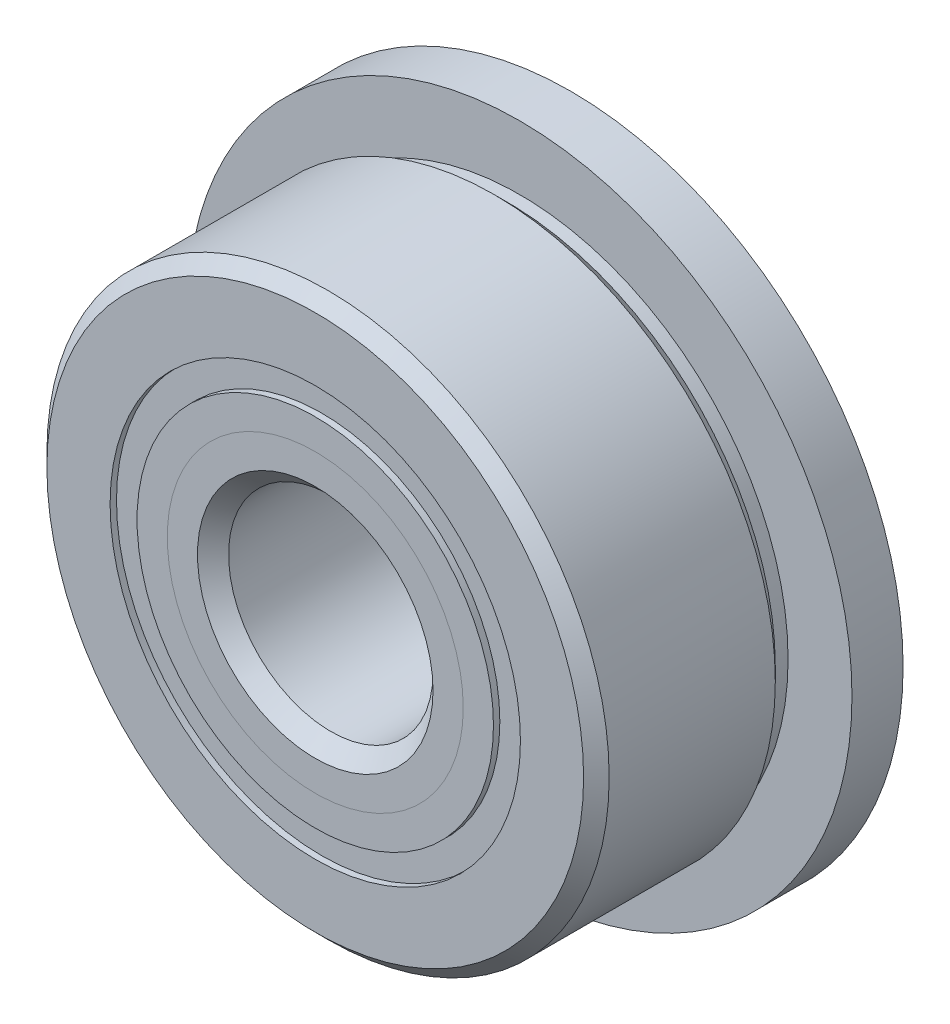
from build123d import *

# Parameters (mm, degrees)
SKETCH5_W         = 1.5875
SKETCH5_H         = 2.965659341
CIRPATTERN1_COUNT = 10
SKETCH7_W         = 1.957414803
SKETCH7_H         = 0.837362638


with BuildPart() as part:
    # Sketch1 → Revolve1 (revolve)
    with BuildSketch(Plane(origin=(0, 0, 0), x_dir=(0, 0, -1), z_dir=(1, 0, 0)), mode=Mode.PRIVATE) as revolve1_sk:
        with BuildLine():
            Line((3.571875, 8.73125), (-3.571875, 8.73125))
            Line((-3.571875, 8.73125), (-3.96875, 8.334375))
            Line((-3.96875, 8.334375), (-3.96875, 6.371806319))
            Line((-3.96875, 6.371806319), (-1.763888889, 6.371806319))
            ThreePointArc((-1.763888889, 6.371806319), (0, 7.766022697), (1.763888889, 6.371806319))
            Line((1.763888889, 6.371806319), (3.96875, 6.371806319))
            Line((3.96875, 6.371806319), (3.96875, 8.334375))
            Line((3.96875, 8.334375), (3.571875, 8.73125))
        make_face()
    revolve(revolve1_sk.sketch.rotate(Axis((0, 0, 3.96875), (0, 0, -1)), 90), axis=Axis((0, 0, 3.96875), (0, 0, -1)))

    # Sketch5 → Revolve5 (revolve)
    with BuildSketch(Plane(origin=(0, 0, 0), x_dir=(0, 0, -1), z_dir=(1, 0, 0)), mode=Mode.PRIVATE) as revolve5_sk:
        with Locations((3.175, 8.83592033)):
            Rectangle(SKETCH5_W, SKETCH5_H)
    revolve(revolve5_sk.sketch.rotate(Axis((0, 0, -5.55625), (0, 0, 1)), 270), axis=Axis((0, 0, -5.55625), (0, 0, 1)))

    # Sketch6 → Cut-Revolve1 (revolve, cut)
    with BuildSketch(Plane(origin=(0, 0, 0), x_dir=(0, 0, -1), z_dir=(1, 0, 0)), mode=Mode.PRIVATE) as cut_revolve1_sk:
        Polygon((1.5875, 8.73125), (1.984375, 8.334375), (2.38125, 8.334375), (2.38125, 8.73125), align=None)
    revolve(cut_revolve1_sk.sketch.rotate(Axis((0, 0, 3.96875), (0, 0, -1)), 90), axis=Axis((0, 0, 3.96875), (0, 0, -1)), mode=Mode.SUBTRACT)


with BuildPart() as body_2:
    # Sketch2 → Revolve2 (revolve)
    with BuildSketch(Plane(origin=(0, 0, 0), x_dir=(0, 0, -1), z_dir=(1, 0, 0)), mode=Mode.PRIVATE) as revolve2_sk:
        with BuildLine():
            Line((-3.96875, 5.534443681), (-1.763888889, 5.534443681))
            ThreePointArc((-1.763888889, 5.534443681), (-1.124182294, 4.530868965), (0, 4.140227303))
            Line((0, 4.140227303), (0, 3.657613652))
            Line((0, 3.657613652), (-3.030334985, 3.657613652))
            Line((-3.030334985, 3.657613652), (-3.96875, 4.596028666))
            Line((-3.96875, 4.596028666), (-3.96875, 5.534443681))
        make_face()
    revolve(revolve2_sk.sketch.rotate(Axis((0, 0, 3.96875), (0, 0, -1)), 90), axis=Axis((0, 0, 3.96875), (0, 0, -1)))


with BuildPart() as body_3:
    # Sketch3 → Revolve3 (revolve)
    with BuildSketch(Plane(origin=(0, 0, 0), x_dir=(0, 0, -1), z_dir=(1, 0, 0)), mode=Mode.PRIVATE) as revolve3_sk:
        with BuildLine():
            Line((-3.96875, 4.596028666), (-3.030334985, 3.657613652))
            Line((-3.030334985, 3.657613652), (0, 3.657613652))
            Line((0, 3.657613652), (0, 4.140227303))
            ThreePointArc((0, 4.140227303), (1.124182294, 4.530868965), (1.763888889, 5.534443681))
            Line((1.763888889, 5.534443681), (5.55625, 5.534443681))
            Line((5.55625, 5.534443681), (5.55625, 3.571875))
            Line((5.55625, 3.571875), (5.159375, 3.175))
            Line((5.159375, 3.175), (-3.486136348, 3.175))
            Line((-3.486136348, 3.175), (-3.96875, 3.657613652))
            Line((-3.96875, 3.657613652), (-3.96875, 4.596028666))
        make_face()
    revolve(revolve3_sk.sketch.rotate(Axis((0, 0, 3.96875), (0, 0, -1)), 90), axis=Axis((0, 0, 3.96875), (0, 0, -1)))


with BuildPart() as body_4:
    # Sketch4 → Revolve4 (revolve)
    with BuildSketch(Plane(origin=(0, 0, 0), x_dir=(0, 0, -1), z_dir=(1, 0, 0))):
        with BuildLine():
            Line((-1.812897697, 5.953125), (1.812897697, 5.953125))
            ThreePointArc((1.812897697, 5.953125), (0, 7.766022697), (-1.812897697, 5.953125))
        make_face()
    revolve(axis=Axis((0, 5.953125, 1.812897697), (0, 0, -1)))


with BuildPart() as cirpattern1_1:
    # CirPattern1: pattern copy
    add(body_4.part.rotate(Axis((0, 0, 0), (0, 0, 1)), 1 * 360 / CIRPATTERN1_COUNT))


with BuildPart() as cirpattern1_2:
    # CirPattern1: pattern copy
    add(body_4.part.rotate(Axis((0, 0, 0), (0, 0, 1)), 2 * 360 / CIRPATTERN1_COUNT))


with BuildPart() as cirpattern1_3:
    # CirPattern1: pattern copy
    add(body_4.part.rotate(Axis((0, 0, 0), (0, 0, 1)), 3 * 360 / CIRPATTERN1_COUNT))


with BuildPart() as cirpattern1_4:
    # CirPattern1: pattern copy
    add(body_4.part.rotate(Axis((0, 0, 0), (0, 0, 1)), 4 * 360 / CIRPATTERN1_COUNT))


with BuildPart() as cirpattern1_5:
    # CirPattern1: pattern copy
    add(body_4.part.rotate(Axis((0, 0, 0), (0, 0, 1)), 5 * 360 / CIRPATTERN1_COUNT))


with BuildPart() as cirpattern1_6:
    # CirPattern1: pattern copy
    add(body_4.part.rotate(Axis((0, 0, 0), (0, 0, 1)), 6 * 360 / CIRPATTERN1_COUNT))


with BuildPart() as cirpattern1_7:
    # CirPattern1: pattern copy
    add(body_4.part.rotate(Axis((0, 0, 0), (0, 0, 1)), 7 * 360 / CIRPATTERN1_COUNT))


with BuildPart() as cirpattern1_8:
    # CirPattern1: pattern copy
    add(body_4.part.rotate(Axis((0, 0, 0), (0, 0, 1)), 8 * 360 / CIRPATTERN1_COUNT))


with BuildPart() as cirpattern1_9:
    # CirPattern1: pattern copy
    add(body_4.part.rotate(Axis((0, 0, 0), (0, 0, 1)), 9 * 360 / CIRPATTERN1_COUNT))


with BuildPart() as body_14:
    # Sketch7 → Revolve6 (revolve)
    with BuildSketch(Plane(origin=(0, 0, 0), x_dir=(0, 0, -1), z_dir=(1, 0, 0)), mode=Mode.PRIVATE) as revolve6_sk:
        with Locations((-2.791605099, 5.953125)):
            Rectangle(SKETCH7_W, SKETCH7_H)
        with Locations((2.791605099, 5.953125)):
            Rectangle(SKETCH7_W, SKETCH7_H)
    revolve(revolve6_sk.sketch.rotate(Axis((0, 0, 3.96875), (0, 0, -1)), 90), axis=Axis((0, 0, 3.96875), (0, 0, -1)))


solid = Compound([part.part, body_2.part, body_3.part, body_4.part, cirpattern1_1.part, cirpattern1_2.part, cirpattern1_3.part, cirpattern1_4.part, cirpattern1_5.part, cirpattern1_6.part, cirpattern1_7.part, cirpattern1_8.part, cirpattern1_9.part, body_14.part])
